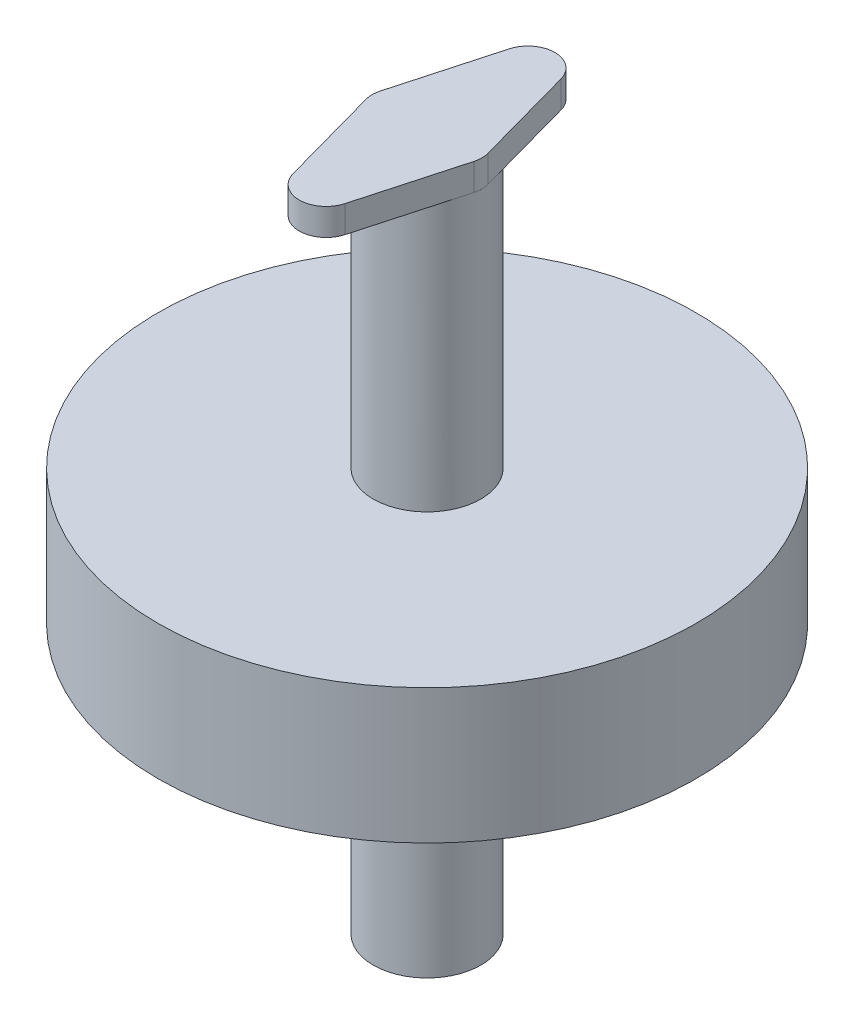
from build123d import *

# Parameters (mm, degrees)
CROQUIS1_R                   = 10
SALIENTE_EXTRUIR1_DEPTH      = 5
SALIENTE_EXTRUIR2_DEPTH      = 10
SALIENTE_EXTRUIR2_DEPTH_BACK = 15
CROQUIS2_R                   = 2
SALIENTE_EXTRUIR3_DEPTH      = 1
REDONDEO1_R                  = 1


with BuildPart() as part:
    # Croquis1 → Saliente-Extruir1 (new body)
    with BuildSketch(Plane(origin=(0, 0, 0), x_dir=(1, 0, 0), z_dir=(0, 1, 0))):
        with Locations(Location((0, 0, 0), (0, 0, 270))):
            Circle(CROQUIS1_R)
    extrude(amount=SALIENTE_EXTRUIR1_DEPTH)

    # Croquis2 → Saliente-Extruir2 (add, two sides: drawn at the far end of the back side and taken through both)
    with BuildSketch(Plane(origin=(0, 5, 0), x_dir=(1, 0, 0), z_dir=(0, 1, 0)).offset(-SALIENTE_EXTRUIR2_DEPTH_BACK)):
        with Locations(Location((0, 0, 0), (0, 0, 270))):
            Circle(CROQUIS2_R)
    extrude(amount=SALIENTE_EXTRUIR2_DEPTH + SALIENTE_EXTRUIR2_DEPTH_BACK)

    # Croquis3 → Saliente-Extruir3 (add)
    with BuildSketch(Plane(origin=(0, 15, 0), x_dir=(1, 0, 0), z_dir=(0, 1, 0))):
        Polygon((-2.075143392, 0), (0, 7.5), (2.075143392, 0), (0, -7.5), align=None)
    extrude(amount=SALIENTE_EXTRUIR3_DEPTH)

    # Redondeo1
    redondeo1_edges = [part.edges().sort_by_distance(p)[0] for p in [
        (-2.075143392, 15.5, 0),
        (0, 15.5, 7.5),
        (2.075143392, 15.5, 0),
        (0, 15.5, -7.5),
    ]]
    fillet(redondeo1_edges, radius=REDONDEO1_R)


solid = part.part
